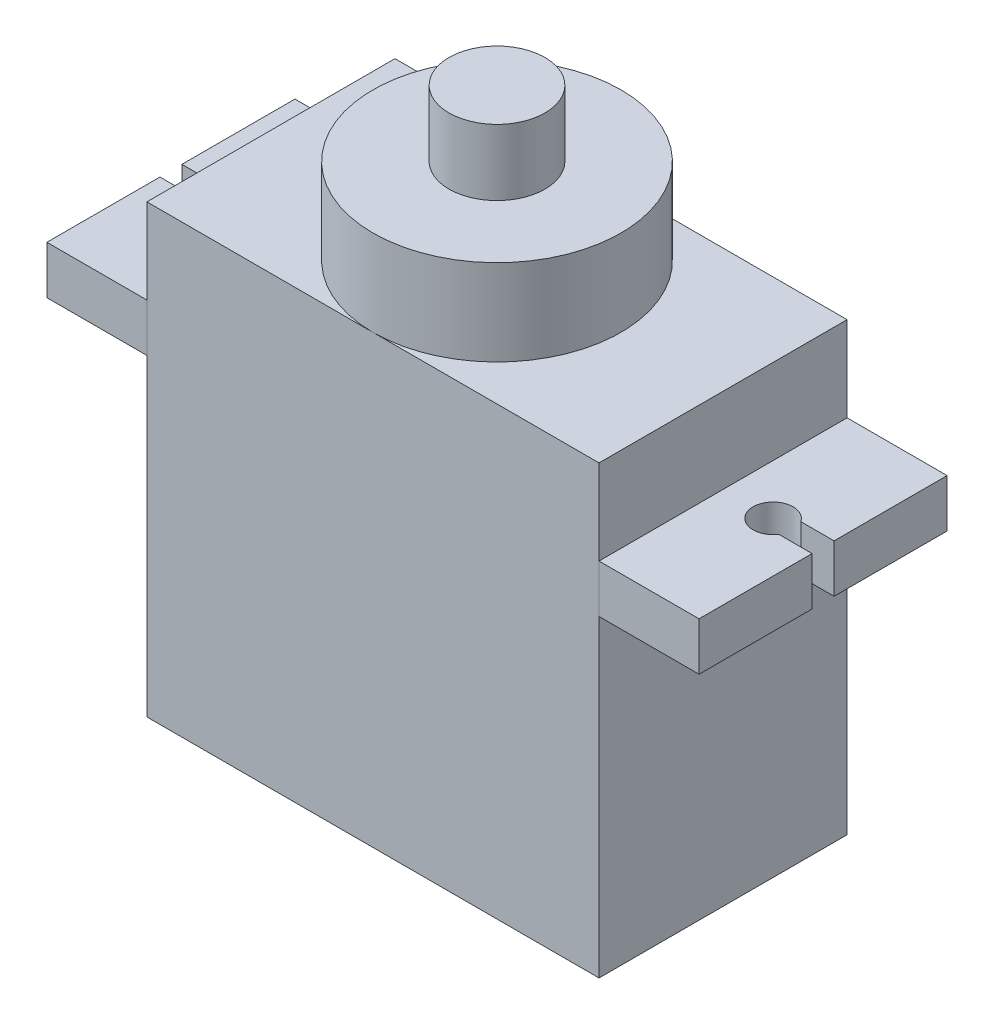
from build123d import *

# Parameters (mm, degrees)
SKETCH_1_W          = 22.6
SKETCH_1_H          = 12.4
EXTRUDE_1_DEPTH     = 22.3
SKETCH_2_W          = 5
SKETCH_2_H          = 2.4
EXTRUDE_2_DEPTH     = 12.4
EXTRUDE_2_2_DEPTH   = 12.4
CUT_EXTRUDE_1_DEPTH = 26.098456128
SKETCH_4_R          = 6.2
EXTRUDE_3_DEPTH     = 4.3
SKETCH_5_R          = 2.4
EXTRUDE_4_DEPTH     = 3.3
SKETCH_6_R          = 0.6
EXTRUDE_8_DEPTH     = 2.3
EXTRUDE_8_2_DEPTH   = 2.3
EXTRUDE_8_3_DEPTH   = 2.3


with BuildPart() as part:
    # 草图1 → 凸台-拉伸1 (new body)
    with BuildSketch(Plane(origin=(0, 0, 0), x_dir=(1, 0, 0), z_dir=(0, 1, 0))):
        Rectangle(SKETCH_1_W, SKETCH_1_H)
    extrude(amount=EXTRUDE_1_DEPTH)

    # 草图4 → 凸台-拉伸3 (add)
    with BuildSketch(Plane(origin=(0, 22.3, 0), x_dir=(1, 0, 0), z_dir=(0, 1, 0))):
        with Locations(Location((0, 0, 0), (0, 0, 270))):
            Circle(SKETCH_4_R)
    extrude(amount=EXTRUDE_3_DEPTH)

    # 草图5 → 凸台-拉伸4 (add)
    with BuildSketch(Plane(origin=(0, 26.6, 0), x_dir=(1, 0, 0), z_dir=(0, 1, 0))):
        with Locations(Location((0, 0, 0), (0, 0, 270))):
            Circle(SKETCH_5_R)
    extrude(amount=EXTRUDE_4_DEPTH)


with BuildPart() as body_2:
    # 草图2 → 凸台-拉伸2 (new, through all)
    with BuildSketch(Plane.XY.offset(6.2)):
        with Locations((13.8, 16.85)):
            Rectangle(SKETCH_2_W, SKETCH_2_H)
    extrude(amount=-EXTRUDE_2_DEPTH)


with BuildPart() as body_3:
    # 草图2 → Extrude 2 2 (new, through all)
    with BuildSketch(Plane.XY.offset(6.2)):
        with Locations((-13.8, 16.85)):
            Rectangle(SKETCH_2_W, SKETCH_2_H)
    extrude(amount=-EXTRUDE_2_2_DEPTH)


with BuildPart() as cut_extrude_1_tool:
    # 草图3 → 切除-拉伸1 (new, through all)
    with BuildSketch(Plane(origin=(0, 18.05, 0), x_dir=(1, 0, 0), z_dir=(0, 1, 0))):
        with BuildLine():
            Line((14.635164654, 0.55), (16.3, 0.55))
            Line((16.3, 0.55), (16.3, -0.55))
            Line((16.3, -0.55), (14.635164654, -0.55))
            ThreePointArc((14.635164654, -0.55), (12.8, 0), (14.635164654, 0.55))
        make_face()
        with BuildLine():
            Line((-14.635164654, -0.55), (-16.3, -0.55))
            Line((-16.3, -0.55), (-16.3, 0.55))
            Line((-16.3, 0.55), (-14.635164654, 0.55))
            ThreePointArc((-14.635164654, 0.55), (-12.8, 0), (-14.635164654, -0.55))
        make_face()
    extrude(amount=-CUT_EXTRUDE_1_DEPTH)


with BuildPart() as body_2_1:
    add(body_2.part)

    # 切除-拉伸1: cut by cut_extrude_1_tool
    add(cut_extrude_1_tool.part, mode=Mode.SUBTRACT)


with BuildPart() as body_3_1:
    add(body_3.part)

    # 切除-拉伸1: cut by cut_extrude_1_tool
    add(cut_extrude_1_tool.part, mode=Mode.SUBTRACT)


with BuildPart() as body_4:
    # 草图6 → 凸台-拉伸8 (new body)
    with BuildSketch(Plane.ZY.offset(11.3)):
        with Locations((0, 4.5)):
            Circle(SKETCH_6_R)
    extrude(amount=EXTRUDE_8_DEPTH)


with BuildPart() as body_5:
    # 草图6 → Extrude 8 2 (new body)
    with BuildSketch(Plane.ZY.offset(11.3)):
        with Locations((1.2, 4.5)):
            Circle(SKETCH_6_R)
    extrude(amount=EXTRUDE_8_2_DEPTH)


with BuildPart() as body_6:
    # 草图6 → Extrude 8 3 (new body)
    with BuildSketch(Plane.ZY.offset(11.3)):
        with Locations((-1.2, 4.5)):
            Circle(SKETCH_6_R)
    extrude(amount=EXTRUDE_8_3_DEPTH)


solid = Compound([part.part, body_2_1.part, body_3_1.part, body_4.part, body_5.part, body_6.part])
